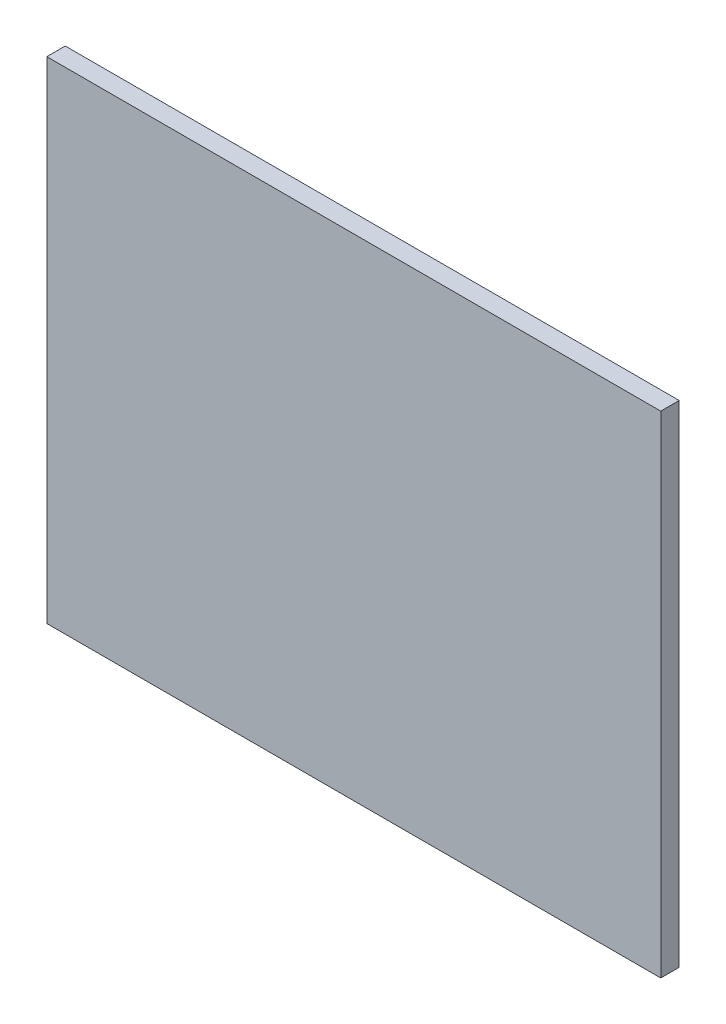
from build123d import *

# Parameters (mm, degrees)
SKICA1_W                = 99.8
SKICA1_H                = 79.8
P_IDAT_VYSUNUT_M1_DEPTH = 3


with BuildPart() as part:
    # Skica1 → Přidat vysunutím1 (new body)
    with BuildSketch(Plane.XY):
        with Locations((49.9, 39.9)):
            Rectangle(SKICA1_W, SKICA1_H)
    extrude(amount=P_IDAT_VYSUNUT_M1_DEPTH)


solid = part.part
